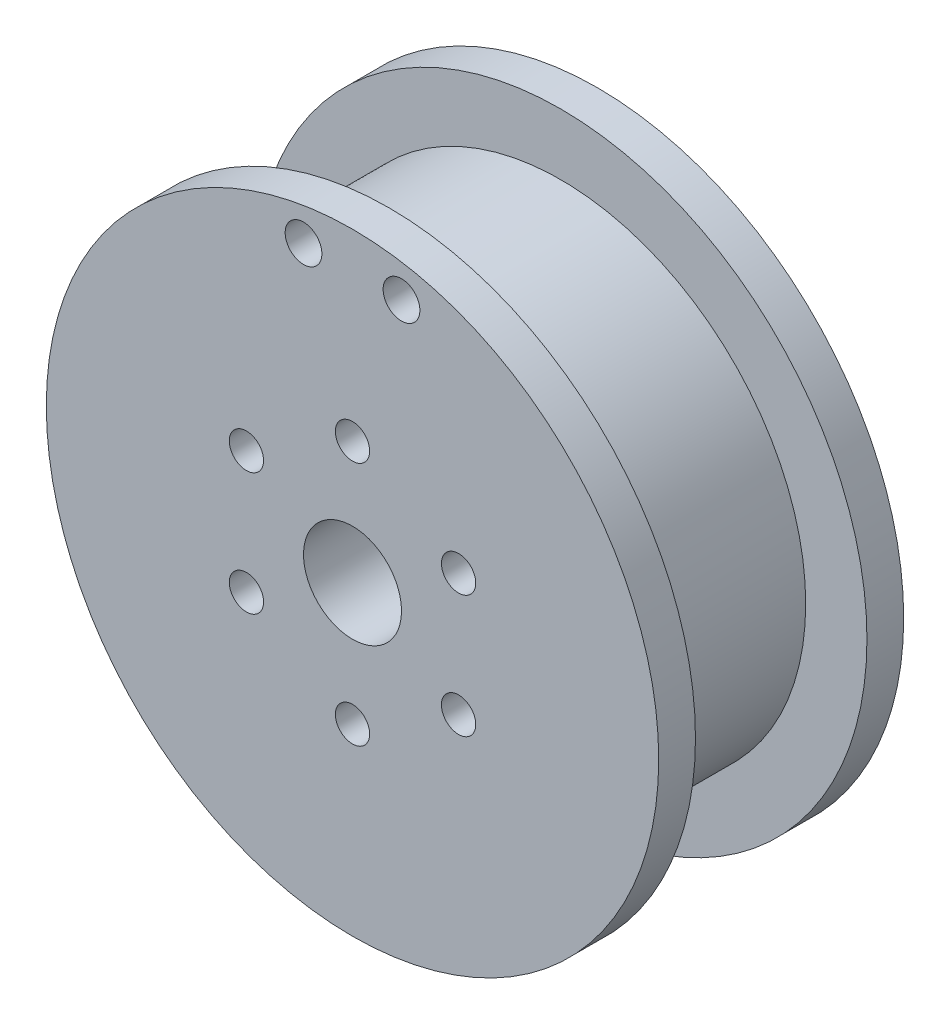
from build123d import *

# Parameters (mm, degrees)
SKETCH3_R          = 1.4
CUT_EXTRUDE1_DEPTH = 41.620192023
SKETCH5_R          = 1.5
CUT_EXTRUDE2_DEPTH = 40.230090492


with BuildPart() as part:
    # Sketch2 → Revolve1 (revolve)
    with BuildSketch(Plane(origin=(0, 0, 0), x_dir=(0, 0, -1), z_dir=(1, 0, 0))):
        Polygon((10, 4), (10, 25), (7, 25), (7, 20), (-7, 20), (-7, 25), (-10, 25), (-10, 4), align=None)
    revolve(axis=Axis((0, 0, 10), (0, 0, -1)))

    # Sketch3 → Cut-Extrude1 (cut, through all)
    with BuildSketch(Plane.XY.offset(10)):
        with Locations((0, 10)):
            Circle(SKETCH3_R)
        with Locations((8.660254038, 5)):
            Circle(SKETCH3_R)
        with Locations((8.660254038, -5)):
            Circle(SKETCH3_R)
        with Locations((0, -10)):
            Circle(SKETCH3_R)
        with Locations((-8.660254038, -5)):
            Circle(SKETCH3_R)
        with Locations((-8.660254038, 5)):
            Circle(SKETCH3_R)
    extrude(amount=-CUT_EXTRUDE1_DEPTH, mode=Mode.SUBTRACT)

    # Sketch5 → Cut-Extrude2 (cut, through all)
    with BuildSketch(Plane(origin=(0, 0, 7), x_dir=(-1, 0, 0), z_dir=(0, 0, -1))):
        with Locations((-4, 22)):
            Circle(SKETCH5_R)
        with Locations((4, 22)):
            Circle(SKETCH5_R)
    extrude(amount=-CUT_EXTRUDE2_DEPTH, mode=Mode.SUBTRACT)


solid = part.part
